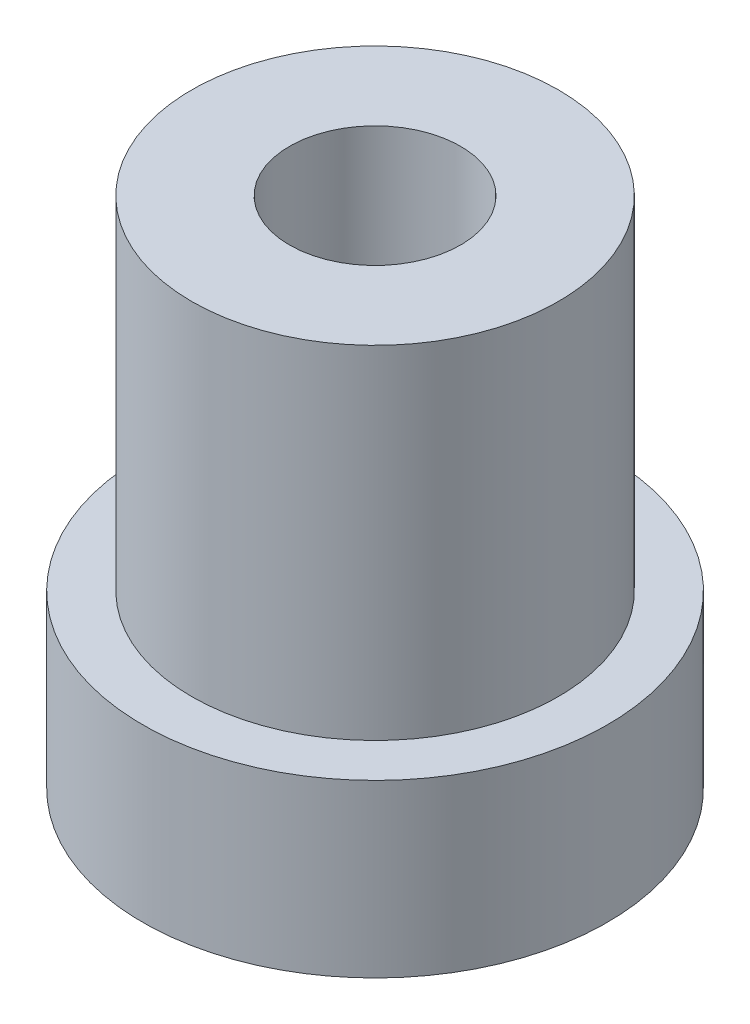
from build123d import *

# Parameters (mm, degrees)
SKETCH1_R                  = 3.75
BOSS_EXTRUDE1_DEPTH        = 10.5
F_3_5_3_5_DIAMETER_HOLE1_D = 3.5
SKETCH4_R                  = 4.75
BOSS_EXTRUDE2_DEPTH        = 3.5


with BuildPart() as part:
    # Sketch1 → Boss-Extrude1 (new body)
    with BuildSketch(Plane(origin=(0, 0, 0), x_dir=(1, 0, 0), z_dir=(0, 1, 0))):
        with Locations(Location((0, 0, 0), (0, 0, 90))):
            Circle(SKETCH1_R)
    extrude(amount=BOSS_EXTRUDE1_DEPTH)

    # Ø3.5 (3.5) Diameter Hole1 (through all)
    with Locations(Plane(origin=(0, 10.5, 0), x_dir=(1, 0, 0), z_dir=(0, 1, 0))):
        with Locations((0, 0)):
            Hole(F_3_5_3_5_DIAMETER_HOLE1_D / 2)

    # Sketch4 → Boss-Extrude2 (add)
    with BuildSketch(Plane.XZ):
        with Locations(Location((0, 0, 0), (0, 0, 270))):
            Circle(SKETCH4_R)
    extrude(amount=-BOSS_EXTRUDE2_DEPTH)


solid = part.part
